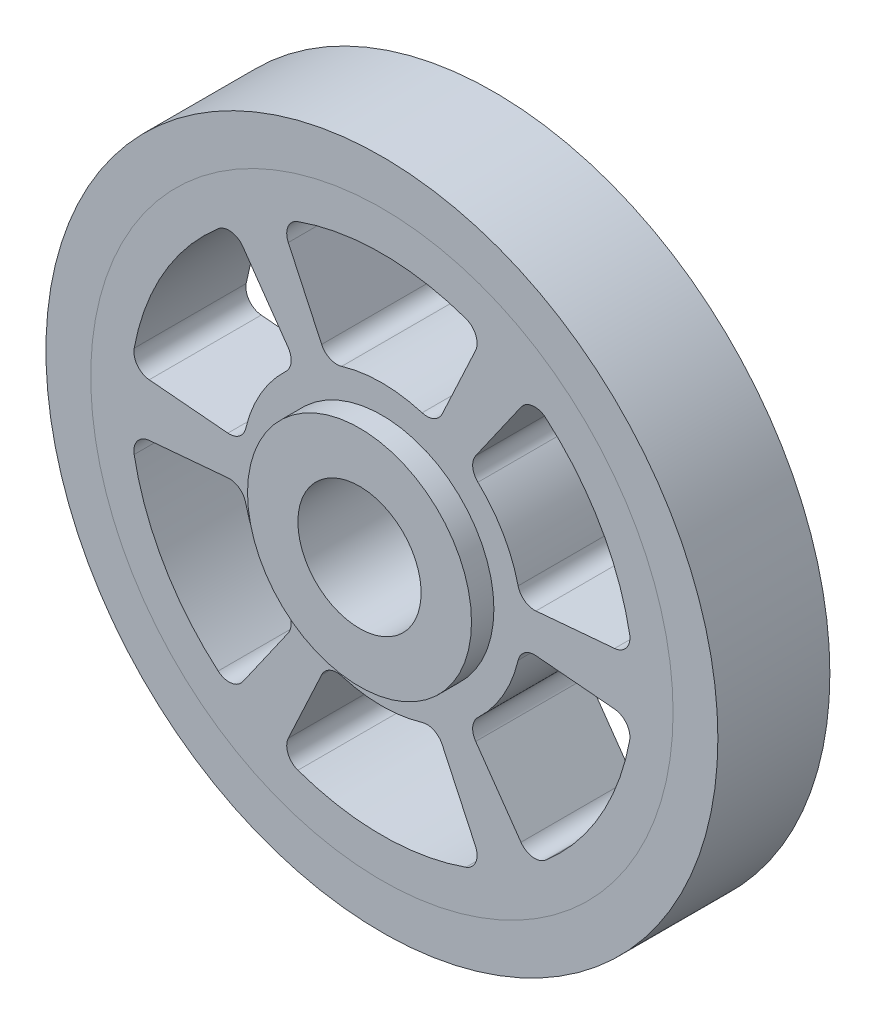
from build123d import *

# Parameters (mm, degrees)
SKETCH1_R                = 76.2
SKETCH1_R_2              = 66.04
BOSS_EXTRUDE1_DEPTH      = 25.4
SKETCH2_R                = 66.04
SKETCH2_R_2              = 25.4
BOSS_EXTRUDE2_DEPTH      = 25.4
BOSS_EXTRUDE3_DEPTH      = 17.78
BOSS_EXTRUDE3_DEPTH_BACK = 17.78
SKETCH3_R                = 25.4
SKETCH3_R_2              = 13.97


with BuildPart() as part:
    # Sketch1 → Boss-Extrude1 (new body)
    with BuildSketch(Plane.XY):
        Circle(SKETCH1_R)
        Circle(SKETCH1_R_2, mode=Mode.SUBTRACT)
    extrude(amount=BOSS_EXTRUDE1_DEPTH)


with BuildPart() as body_2:
    # Sketch2 → Boss-Extrude2 (new body)
    with BuildSketch(Plane.XY):
        Circle(SKETCH2_R)
        Circle(SKETCH2_R_2, mode=Mode.SUBTRACT)
        with BuildLine():
            Line((13.665983216, 32.451668782), (21.233032669, 48.679258701))
            ThreePointArc((21.233032669, 48.679258701), (21.293215559, 51.763685423), (19.05, 53.881536726))
            ThreePointArc((19.05, 53.881536726), (0, 57.15), (-19.05, 53.881536726))
            ThreePointArc((-19.05, 53.881536726), (-21.293215559, 51.763685423), (-21.233032669, 48.679258701))
            Line((-21.233032669, 48.679258701), (-13.665983216, 32.451668782))
            ThreePointArc((-13.665983216, 32.451668782), (-11.772009299, 30.585433018), (-9.118705846, 30.412361035))
            ThreePointArc((-9.118705846, 30.412361035), (0, 31.75), (9.118705846, 30.412361035))
            ThreePointArc((9.118705846, 30.412361035), (11.772009299, 30.585433018), (13.665983216, 32.451668782))
        make_face(mode=Mode.SUBTRACT)
        with BuildLine():
            Line((34.936961168, 4.390745758), (52.773991007, 5.95128366))
            ThreePointArc((52.773991007, 5.95128366), (55.475274349, 7.44137711), (56.1877796, 10.442984421))
            ThreePointArc((56.1877796, 10.442984421), (49.493351826, 28.575), (37.1377796, 43.438552305))
            ThreePointArc((37.1377796, 43.438552305), (34.182058791, 44.322308314), (31.540958338, 42.727975041))
            Line((31.540958338, 42.727975041), (21.270977952, 28.060923023))
            ThreePointArc((21.270977952, 28.060923023), (20.60175733, 25.487575615), (21.778524322, 23.103211429))
            ThreePointArc((21.778524322, 23.103211429), (27.49630657, 15.875), (30.897230168, 7.309149605))
            ThreePointArc((30.897230168, 7.309149605), (32.373766629, 5.097857403), (34.936961168, 4.390745758))
        make_face(mode=Mode.SUBTRACT)
        with BuildLine():
            Line((21.270977952, -28.060923023), (31.540958338, -42.727975041))
            ThreePointArc((31.540958338, -42.727975041), (34.182058791, -44.322308314), (37.1377796, -43.438552305))
            ThreePointArc((37.1377796, -43.438552305), (49.493351826, -28.575), (56.1877796, -10.442984421))
            ThreePointArc((56.1877796, -10.442984421), (55.475274349, -7.44137711), (52.773991007, -5.95128366))
            Line((52.773991007, -5.95128366), (34.936961168, -4.390745758))
            ThreePointArc((34.936961168, -4.390745758), (32.373766629, -5.097857403), (30.897230168, -7.309149605))
            ThreePointArc((30.897230168, -7.309149605), (27.49630657, -15.875), (21.778524322, -23.103211429))
            ThreePointArc((21.778524322, -23.103211429), (20.60175733, -25.487575615), (21.270977952, -28.060923023))
        make_face(mode=Mode.SUBTRACT)
        with BuildLine():
            Line((-13.665983216, -32.451668782), (-21.233032669, -48.679258701))
            ThreePointArc((-21.233032669, -48.679258701), (-21.293215559, -51.763685423), (-19.05, -53.881536726))
            ThreePointArc((-19.05, -53.881536726), (0, -57.15), (19.05, -53.881536726))
            ThreePointArc((19.05, -53.881536726), (21.293215559, -51.763685423), (21.233032669, -48.679258701))
            Line((21.233032669, -48.679258701), (13.665983216, -32.451668782))
            ThreePointArc((13.665983216, -32.451668782), (11.772009299, -30.585433018), (9.118705846, -30.412361035))
            ThreePointArc((9.118705846, -30.412361035), (0, -31.75), (-9.118705846, -30.412361035))
            ThreePointArc((-9.118705846, -30.412361035), (-11.772009299, -30.585433018), (-13.665983216, -32.451668782))
        make_face(mode=Mode.SUBTRACT)
        with BuildLine():
            Line((-34.936961168, -4.390745758), (-52.773991007, -5.95128366))
            ThreePointArc((-52.773991007, -5.95128366), (-55.475274349, -7.44137711), (-56.1877796, -10.442984421))
            ThreePointArc((-56.1877796, -10.442984421), (-49.493351826, -28.575), (-37.1377796, -43.438552305))
            ThreePointArc((-37.1377796, -43.438552305), (-34.182058791, -44.322308314), (-31.540958338, -42.727975041))
            Line((-31.540958338, -42.727975041), (-21.270977952, -28.060923023))
            ThreePointArc((-21.270977952, -28.060923023), (-20.60175733, -25.487575615), (-21.778524322, -23.103211429))
            ThreePointArc((-21.778524322, -23.103211429), (-27.49630657, -15.875), (-30.897230168, -7.309149605))
            ThreePointArc((-30.897230168, -7.309149605), (-32.373766629, -5.097857403), (-34.936961168, -4.390745758))
        make_face(mode=Mode.SUBTRACT)
        with BuildLine():
            Line((-21.270977952, 28.060923023), (-31.540958338, 42.727975041))
            ThreePointArc((-31.540958338, 42.727975041), (-34.182058791, 44.322308314), (-37.1377796, 43.438552305))
            ThreePointArc((-37.1377796, 43.438552305), (-49.493351826, 28.575), (-56.1877796, 10.442984421))
            ThreePointArc((-56.1877796, 10.442984421), (-55.475274349, 7.44137711), (-52.773991007, 5.95128366))
            Line((-52.773991007, 5.95128366), (-34.936961168, 4.390745758))
            ThreePointArc((-34.936961168, 4.390745758), (-32.373766629, 5.097857403), (-30.897230168, 7.309149605))
            ThreePointArc((-30.897230168, 7.309149605), (-27.49630657, 15.875), (-21.778524322, 23.103211429))
            ThreePointArc((-21.778524322, 23.103211429), (-20.60175733, 25.487575615), (-21.270977952, 28.060923023))
        make_face(mode=Mode.SUBTRACT)
    extrude(amount=BOSS_EXTRUDE2_DEPTH)


with BuildPart() as body_3:
    # Sketch3 → Boss-Extrude3 (new, two sides: drawn at the far end of the back side and taken through both)
    with BuildSketch(Plane(origin=(0, 0, 12.7), x_dir=(-1, 0, 0), z_dir=(0, 0, -1)).offset(-BOSS_EXTRUDE3_DEPTH_BACK)):
        Circle(SKETCH3_R)
        Circle(SKETCH3_R_2, mode=Mode.SUBTRACT)
    extrude(amount=BOSS_EXTRUDE3_DEPTH + BOSS_EXTRUDE3_DEPTH_BACK)


solid = Compound([part.part, body_2.part, body_3.part])
